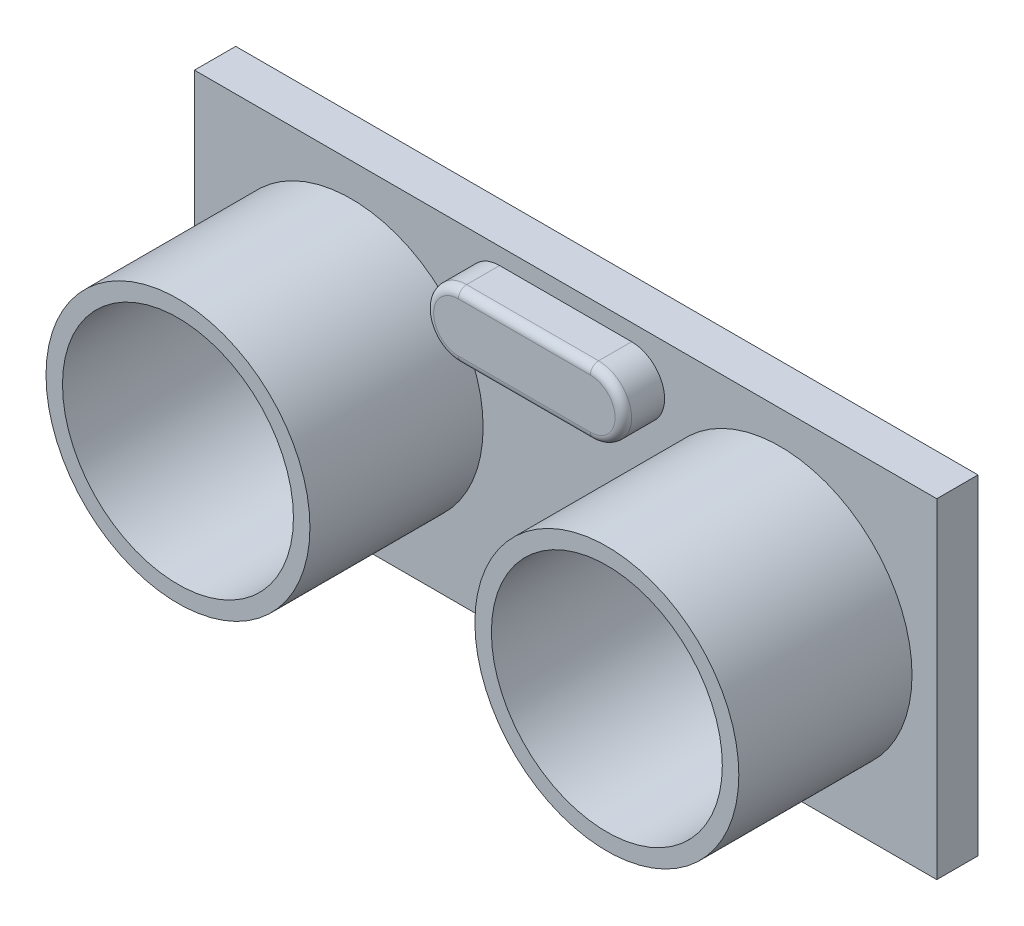
from build123d import *

# Parameters (mm, degrees)
SKETCH1_R             = 8
SKETCH1_R_2           = 7
BOSS_EXTRUDE1_DEPTH   = 12
BOSS_EXTRUDE1_2_DEPTH = 12
SKETCH1_4_W           = 45
SKETCH1_4_H           = 20
SKETCH1_4_R           = 8
BOSS_EXTRUDE2_DEPTH   = 1.5
BOSS_EXTRUDE3_DEPTH   = 4
FILLET1_R             = 0.5
BOSS_EXTRUDE5_DEPTH   = 2
LPATTERN1_COUNT       = 4
LPATTERN1_PITCH       = 2
SKETCH10_R            = 0.2
LPATTERN2_COUNT       = 4
LPATTERN2_PITCH       = 2
SKETCH11_W            = 45
SKETCH11_H            = 20
BOSS_EXTRUDE6_DEPTH   = 1


with BuildPart() as part:
    # Sketch1 → Boss-Extrude1 (new body)
    with BuildSketch(Plane.XY):
        with Locations((13, 0)):
            Circle(SKETCH1_R)
        with Locations((13, 0)):
            Circle(SKETCH1_R_2, mode=Mode.SUBTRACT)
    extrude(amount=BOSS_EXTRUDE1_DEPTH)



with BuildPart() as body_2:
    # Sketch1 → Boss-Extrude1 2 (new body)
    with BuildSketch(Plane.XY):
        with Locations((-13, 0)):
            Circle(SKETCH1_R)
        with Locations((-13, 0)):
            Circle(SKETCH1_R_2, mode=Mode.SUBTRACT)
    extrude(amount=BOSS_EXTRUDE1_2_DEPTH)


with BuildPart() as part_1:
    add(part.part)

    add(body_2.part)  # Boss-Extrude2 merges body 2
    # Sketch1<4> → Boss-Extrude2 (add)
    with BuildSketch(Plane.XY):
        Rectangle(SKETCH1_4_W, SKETCH1_4_H)
        with Locations((-13, 0)):
            Circle(SKETCH1_4_R, mode=Mode.SUBTRACT)
        with Locations((13, 0)):
            Circle(SKETCH1_4_R, mode=Mode.SUBTRACT)
        with BuildLine():
            ThreePointArc((-4, 4.991849634), (-6, 6.991849634), (-4, 8.991849634))
            Line((-4, 8.991849634), (4, 8.991849634))
            ThreePointArc((4, 8.991849634), (6, 6.991849634), (4, 4.991849634))
            Line((4, 4.991849634), (-4, 4.991849634))
        make_face(mode=Mode.SUBTRACT)
    extrude(amount=BOSS_EXTRUDE2_DEPTH)

    # Sketch1<5> → Boss-Extrude3 (add)
    with BuildSketch(Plane.XY):
        with BuildLine():
            Line((4, 8.991849634), (-4, 8.991849634))
            ThreePointArc((-4, 8.991849634), (-6, 6.991849634), (-4, 4.991849634))
            Line((-4, 4.991849634), (4, 4.991849634))
            ThreePointArc((4, 4.991849634), (6, 6.991849634), (4, 8.991849634))
        make_face()
    extrude(amount=BOSS_EXTRUDE3_DEPTH)

    # Fillet1
    fillet1_edges = [part_1.edges().sort_by_distance(p)[0] for p in [
        (-6, 6.991849634, 4),
        (0, 4.991849634, 4),
        (6, 6.991849634, 4),
        (0, 8.991849634, 4),
    ]]
    fillet(fillet1_edges, radius=FILLET1_R)

    # Sketch2 → Boss-Extrude5 (add)
    with BuildSketch(Plane(origin=(0, 0, 0), x_dir=(-1, 0, 0), z_dir=(0, 0, -1))):
        with BuildLine():
            Line((3, -6.05656326), (4, -6.05656326))
            ThreePointArc((4, -6.05656326), (4.353553391, -6.203009869), (4.5, -6.55656326))
            Line((4.5, -6.55656326), (4.5, -7.55656326))
            ThreePointArc((4.5, -7.55656326), (4.353553391, -7.91011665), (4, -8.05656326))
            Line((4, -8.05656326), (3, -8.05656326))
            ThreePointArc((3, -8.05656326), (2.646446609, -7.91011665), (2.5, -7.55656326))
            Line((2.5, -7.55656326), (2.5, -6.55656326))
            ThreePointArc((2.5, -6.55656326), (2.646446609, -6.203009869), (3, -6.05656326))
        make_face()
    boss_extrude5 = extrude(amount=BOSS_EXTRUDE5_DEPTH)

    # LPattern1: Boss-Extrude5 ×4
    with Locations(*[(i * LPATTERN1_PITCH, 0, 0) for i in range(1, LPATTERN1_COUNT)]):
        add(boss_extrude5)

    # Sweep1: sweep along a path in Sketch9
    with BuildLine(Plane(origin=(2.5, 0, 0), x_dir=(0, 0, -1), z_dir=(1, 0, 0))) as sweep1_path:
        Line((2, -7.056575607), (2.1, -7.056575607))
        ThreePointArc((2.1, -7.056575607), (2.382842712, -7.173732894), (2.5, -7.456575607))
        Line((2.5, -7.456575607), (2.5, -13.056575607))
    # Sketch10 → Sweep1 (sweep)
    with BuildSketch(Plane(origin=(0, 0, -2), x_dir=(-1, 0, 0), z_dir=(0, 0, -1))):
        with Locations((-2.5, -7.056575607)):
            Circle(SKETCH10_R)
    sweep1 = sweep(path=sweep1_path.line)

    # LPattern2: Sweep1 ×4
    with Locations(*[(-i * LPATTERN2_PITCH, 0, 0) for i in range(1, LPATTERN2_COUNT)]):
        add(sweep1)

    # Sketch11 → Boss-Extrude6 (add)
    with BuildSketch(Plane(origin=(0, 0, 0), x_dir=(-1, 0, 0), z_dir=(0, 0, -1))):
        Rectangle(SKETCH11_W, SKETCH11_H)
    extrude(amount=BOSS_EXTRUDE6_DEPTH)


solid = part_1.part
